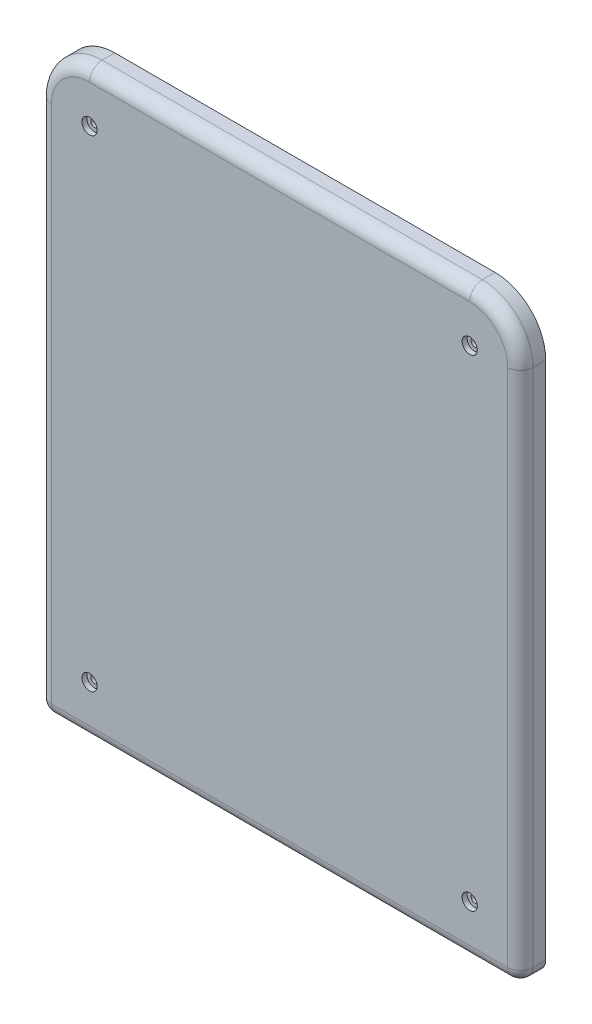
from build123d import *

# Parameters (mm, degrees)
BOSS_EXTRUDE1_DEPTH = 10
FILLET1_R           = 5
CUT_EXTRUDE1_REACH  = 273.931
SKETCH2_R           = 1.5
SKETCH3_R           = 3
CUT_EXTRUDE2_DEPTH  = 2


with BuildPart() as part:
    # Sketch1 → Boss-Extrude1 (new body)
    with BuildSketch(Plane.XY):
        with BuildLine():
            Line((20, 35.715152736), (170, 35.715152736))
            ThreePointArc((170, 35.715152736), (184.142135624, 29.85728836), (190, 15.715152736))
            Line((190, 15.715152736), (190, -189.284847264))
            ThreePointArc((190, -189.284847264), (188.535533906, -192.82038117), (185, -194.284847264))
            Line((185, -194.284847264), (5, -194.284847264))
            ThreePointArc((5, -194.284847264), (1.464466094, -192.82038117), (0, -189.284847264))
            Line((0, -189.284847264), (0, 15.715152736))
            ThreePointArc((0, 15.715152736), (5.857864376, 29.85728836), (20, 35.715152736))
        make_face()
    extrude(amount=BOSS_EXTRUDE1_DEPTH)

    # Fillet1
    fillet1_edges = [part.edges().sort_by_distance(p)[0] for p in [
        (1.464466094, -192.82038117, 10),
        (95, -194.284847264, 10),
        (188.535533906, -192.82038117, 10),
        (190, -86.784847264, 10),
        (184.142135624, 29.85728836, 10),
        (95, 35.715152736, 10),
        (5.857864376, 29.85728836, 10),
        (0, -86.784847264, 10),
    ]]
    fillet(fillet1_edges, radius=FILLET1_R)

    # Sketch2 → Cut-Extrude1 (cut, up to next)
    with BuildSketch(Plane.XY.offset(10), mode=Mode.PRIVATE) as cut_extrude1_sk1:
        with Locations((20, -174.284847264)):
            Circle(SKETCH2_R)
    cut_extrude1_tool1 = extrude(cut_extrude1_sk1.sketch, amount=-CUT_EXTRUDE1_REACH, mode=Mode.PRIVATE) & part.part
    # Sketch2 → Cut-Extrude1 (cut, up to next)
    with BuildSketch(Plane.XY.offset(10), mode=Mode.PRIVATE) as cut_extrude1_sk2:
        with Locations((170, -174.284847264)):
            Circle(SKETCH2_R)
    cut_extrude1_tool2 = extrude(cut_extrude1_sk2.sketch, amount=-CUT_EXTRUDE1_REACH, mode=Mode.PRIVATE) & part.part
    # Sketch2 → Cut-Extrude1 (cut, up to next)
    with BuildSketch(Plane.XY.offset(10), mode=Mode.PRIVATE) as cut_extrude1_sk3:
        with Locations((170, 15.715152736)):
            Circle(SKETCH2_R)
    cut_extrude1_tool3 = extrude(cut_extrude1_sk3.sketch, amount=-CUT_EXTRUDE1_REACH, mode=Mode.PRIVATE) & part.part
    # Sketch2 → Cut-Extrude1 (cut, up to next)
    with BuildSketch(Plane.XY.offset(10), mode=Mode.PRIVATE) as cut_extrude1_sk4:
        with Locations((20, 15.715152736)):
            Circle(SKETCH2_R)
    cut_extrude1_tool4 = extrude(cut_extrude1_sk4.sketch, amount=-CUT_EXTRUDE1_REACH, mode=Mode.PRIVATE) & part.part
    add(cut_extrude1_tool1.solids().sort_by_distance((20, -174.284847, 10))[0], mode=Mode.SUBTRACT)
    add(cut_extrude1_tool2.solids().sort_by_distance((170, -174.284847, 10))[0], mode=Mode.SUBTRACT)
    add(cut_extrude1_tool3.solids().sort_by_distance((170, 15.715153, 10))[0], mode=Mode.SUBTRACT)
    add(cut_extrude1_tool4.solids().sort_by_distance((20, 15.715153, 10))[0], mode=Mode.SUBTRACT)

    # Sketch3 → Cut-Extrude2 (cut)
    with BuildSketch(Plane.XY.offset(10)):
        with Locations((20, 15.715152736)):
            Circle(SKETCH3_R)
        with Locations((170, 15.715152736)):
            Circle(SKETCH3_R)
        with Locations((170, -174.284847264)):
            Circle(SKETCH3_R)
        with Locations((20, -174.284847264)):
            Circle(SKETCH3_R)
    extrude(amount=-CUT_EXTRUDE2_DEPTH, mode=Mode.SUBTRACT)


solid = part.part
